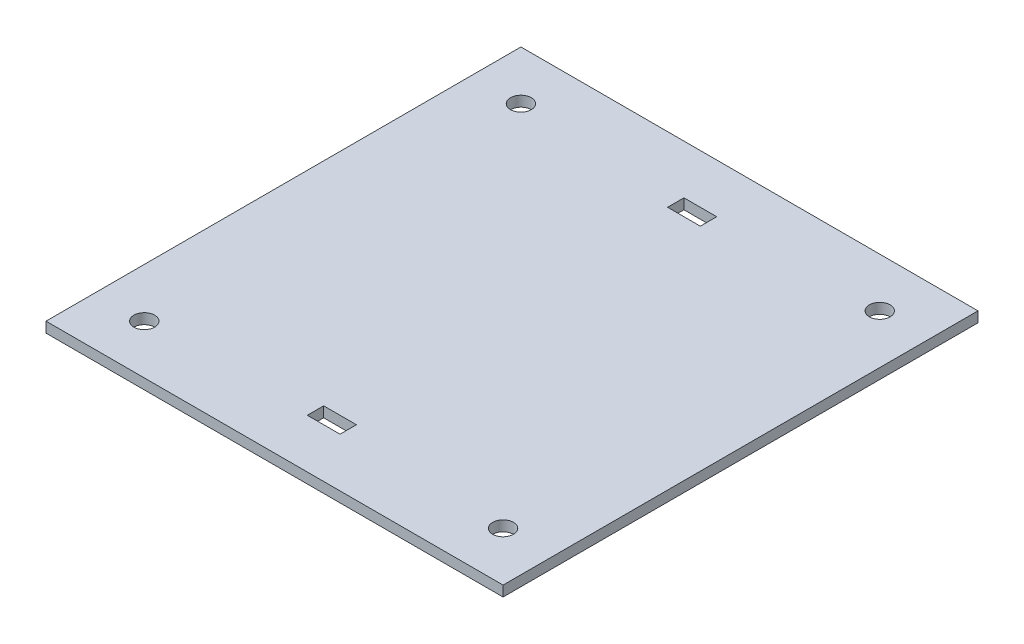
from build123d import *

# Parameters (mm, degrees)
SKETCH1_W           = 139.55
SKETCH1_H           = 145
SKETCH1_R           = 3.175
SKETCH1_W_2         = 10
SKETCH1_H_2         = 5
BOSS_EXTRUDE2_DEPTH = 3.175


with BuildPart() as part:
    # Sketch1 → Boss-Extrude2 (new body)
    with BuildSketch(Plane(origin=(0, 0, 0), x_dir=(1, 0, 0), z_dir=(0, 1, 0))):
        with Locations((69.775, 72.5)):
            Rectangle(SKETCH1_W, SKETCH1_H)
        with Locations(Location((15, 130, 0), (0, 0, 270))):
            Circle(SKETCH1_R, mode=Mode.SUBTRACT)
        with Locations(Location((124.55, 130, 0), (0, 0, 90))):
            Circle(SKETCH1_R, mode=Mode.SUBTRACT)
        with Locations(Location((15, 15, 0), (0, 0, 90))):
            Circle(SKETCH1_R, mode=Mode.SUBTRACT)
        with Locations(Location((124.55, 15, 0), (0, 0, 270))):
            Circle(SKETCH1_R, mode=Mode.SUBTRACT)
        with Locations((69.775, 127.5)):
            Rectangle(SKETCH1_W_2, SKETCH1_H_2, mode=Mode.SUBTRACT)
        with Locations((69.775, 17.5)):
            Rectangle(SKETCH1_W_2, SKETCH1_H_2, mode=Mode.SUBTRACT)
    extrude(amount=BOSS_EXTRUDE2_DEPTH)


solid = part.part
